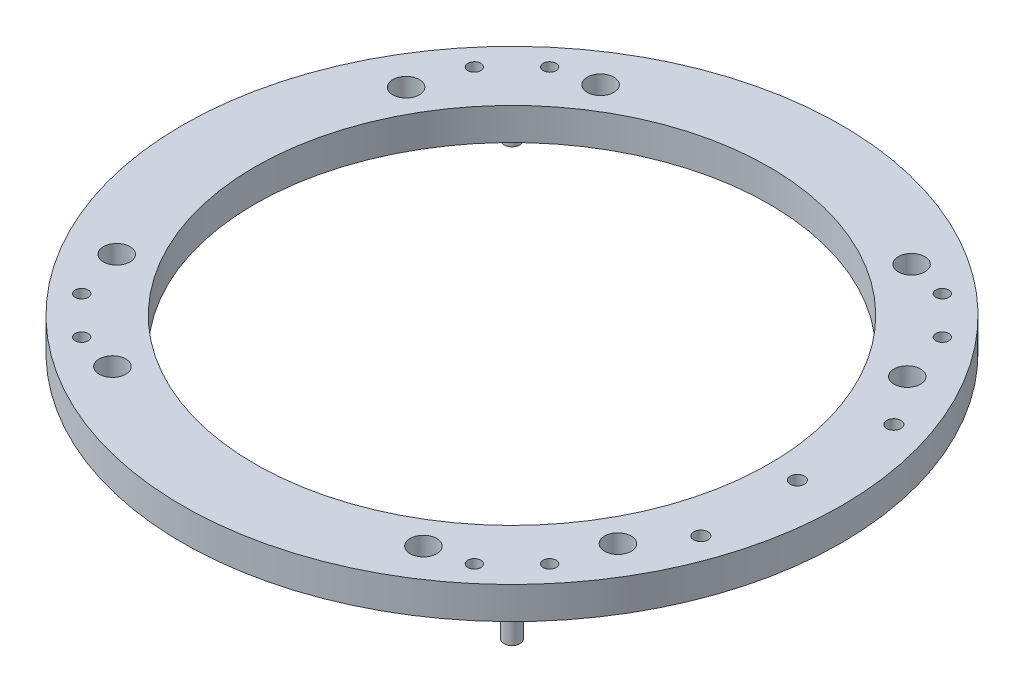
from build123d import *

# Parameters (mm, degrees)
SKETCH6_R                = 3.175
BOSS_EXTRUDE1_DEPTH      = 12.7
F_1_4_20_TAPPED_HOLE1_D  = 5.1054
CIRPATTERN1_COUNT        = 4
F_10_CLEARANCE_HOLE1_D   = 5.6134
Z_0_413_DIAMETER_HOLE1_D = 10.4902


with BuildPart() as part:
    # Sketch1 → Revolve1 (revolve)
    with BuildSketch(Plane.XY):
        Polygon((101.6, 1069.975), (101.6, 1057.275), (114.3, 1057.275), (130.175, 1057.275), (130.175, 1069.975), align=None)
    revolve(axis=Axis((0, 1125.81516809, 0), (0, -1, 0)))

    # Sketch6 → Boss-Extrude1 (add)
    with BuildSketch(Plane.XZ.offset(-1057.275)):
        with Locations((-85.31243315, 85.31243315)):
            Circle(SKETCH6_R)
        with Locations((85.31243315, 85.31243315)):
            Circle(SKETCH6_R)
        with Locations((85.31243315, -85.31243315)):
            Circle(SKETCH6_R)
        with Locations((-85.31243315, -85.31243315)):
            Circle(SKETCH6_R)
    extrude(amount=BOSS_EXTRUDE1_DEPTH)

    # 1/4-20 Tapped Hole1 (through all)
    with Locations(Plane(origin=(0, 1057.275, 0), x_dir=(-1, 0, 0), z_dir=(0, -1, 0))):
        with Locations((77.552325109, 92.423262062), (92.423262062, 77.552325109)):
            f_1_4_20_tapped_hole1 = Hole(F_1_4_20_TAPPED_HOLE1_D / 2)

    # CirPattern1: 1/4-20 Tapped Hole1 ×4 about axis
    cirpattern1_axis = Axis((0, 1125.81516809, 0), (0, 1, 0))
    for i in range(1, CIRPATTERN1_COUNT):
        add(f_1_4_20_tapped_hole1.rotate(cirpattern1_axis, i * 360 / CIRPATTERN1_COUNT), mode=Mode.SUBTRACT)

    # #10 Clearance Hole1 (through all)
    with Locations(Plane(origin=(0, 1069.975, 0), x_dir=(1, 0, 0), z_dir=(0, 1, 0))):
        with Locations((112.7125, 38.1), (112.7125, 0), (112.7125, -38.1)):
            Hole(F_10_CLEARANCE_HOLE1_D / 2)

    # Z (0.413) Diameter Hole1 (through all)
    with Locations(Plane(origin=(0, 1069.975, 0), x_dir=(1, 0, 0), z_dir=(0, 1, 0))):
        with Locations((-98.986703653, -57.15), (98.986703653, -57.15), (98.986703653, 57.15), (-98.986703653, 57.15), (-61.413345234, 96.399642256), (61.413345234, 96.399642256), (61.413345234, -96.399642256), (-61.413345234, -96.399642256)):
            Hole(Z_0_413_DIAMETER_HOLE1_D / 2)


solid = part.part
